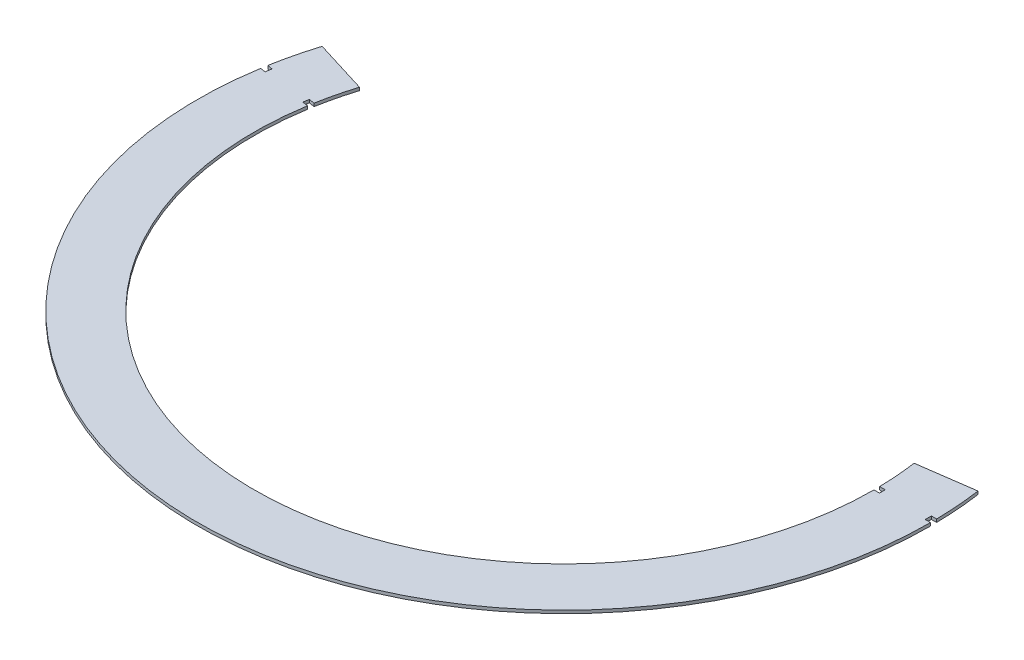
from build123d import *

# Parameters (mm, degrees)
BOSS_EXTRUDE1_DEPTH = 0.7
NOTCH_DEPTH         = 0.7


with BuildPart() as part:
    # Sketch3 → Boss-Extrude1 (new body)
    with BuildSketch(Plane(origin=(0, 0, 0), x_dir=(1, 0, 0), z_dir=(0, 1, 0))):
        with BuildLine():
            Line((-70.309797243, 11.349925621), (-83.143655207, 13.421661553))
            ThreePointArc((-83.143655207, 13.421661553), (-6.732375453, -83.950482552), (84.22, 0))
            Line((84.22, 0), (71.22, 0))
            ThreePointArc((71.22, 0), (-5.693181902, -70.992084628), (-70.309797243, 11.349925621))
        make_face()
    extrude(amount=BOSS_EXTRUDE1_DEPTH)

    # Sketch4 → notch (add)
    with BuildSketch(Plane(origin=(0, 0, 0), x_dir=(1, 0, 0), z_dir=(0, 1, 0))):
        Polygon((83, 1.400205806), (72.5, 1.308573694), (72.5, 0), (83, 0), align=None)
        with BuildLine():
            Line((83.400376749, 11.721158563), (70.526891856, 9.91190825))
            ThreePointArc((70.526891856, 9.91190825), (70.998315276, 5.614946842), (71.208183604, 1.297300183))
            Line((71.208183604, 1.297300183), (72.5, 1.308573694))
            Line((72.5, 1.308573694), (83, 1.400205806))
            Line((83, 1.400205806), (84.208183604, 1.410749464))
            ThreePointArc((84.208183604, 1.410749464), (83.962691178, 6.578365305), (83.400376749, 11.721158563))
        make_face()
    notch = extrude(amount=NOTCH_DEPTH)

    # Mirror1: notch across plane
    add(notch.mirror(Plane(origin=(0, 0, 0), x_dir=(-0.07993796548331146, 0, 0.9967998403262256), z_dir=(-0.9967998403262257, 0, -0.07993796548331145))))


solid = part.part
